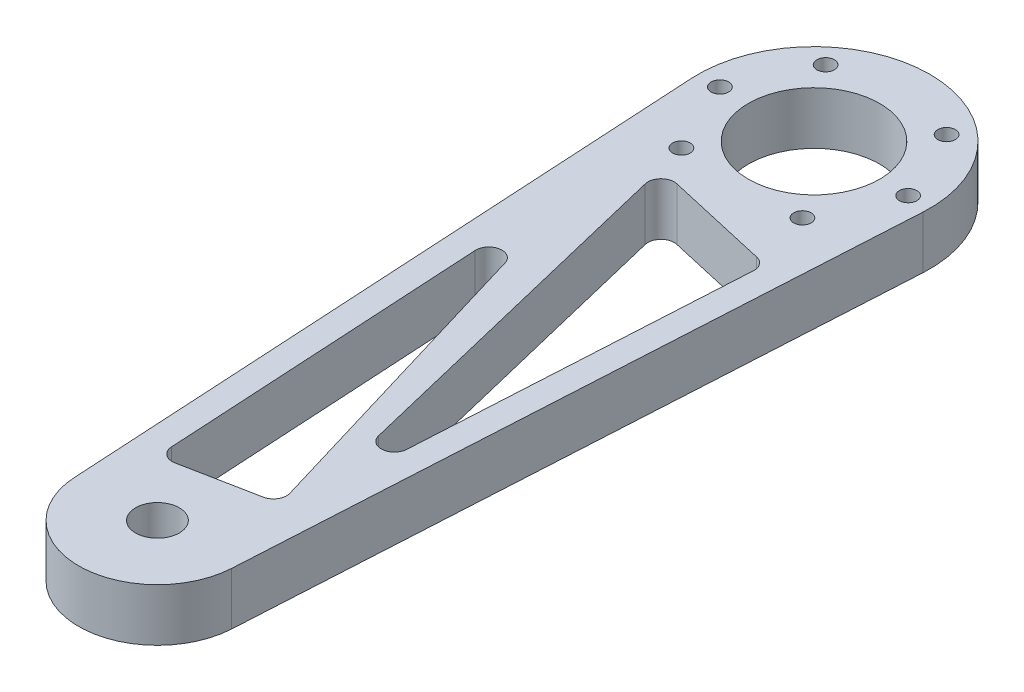
from build123d import *

# Parameters (mm, degrees)
SKETCH_1_R               = 5
SKETCH_1_R_2             = 15
EXTRUDE_1_DEPTH          = 12
FILLET_1_R               = 3
SKETCH_2_R               = 2
CUT_EXTRUDE_1_DEPTH      = 179.881245523
PATTERN_CIRCULAR_3_COUNT = 2
PATTERN_CIRCULAR_3_ANGLE = 50
PATTERN_CIRCULAR_4_COUNT = 2
PATTERN_CIRCULAR_4_ANGLE = 50


with BuildPart() as part:
    # 草图1 → 凸台-拉伸1 (new body)
    with BuildSketch(Plane(origin=(0, 0, 0), x_dir=(1, 0, 0), z_dir=(0, 1, 0))):
        with BuildLine():
            Line((-17.971076762, -1.02), (-26.457418567, 148.498333333))
            ThreePointArc((-26.457418567, 148.498333333), (0, 176.5), (26.457418567, 148.498333333))
            Line((26.457418567, 148.498333333), (17.971076762, -1.02))
            ThreePointArc((17.971076762, -1.02), (0, -18), (-17.971076762, -1.02))
        make_face()
        with Locations(Location((0, 0, 0), (0, 0, 270))):
            Circle(SKETCH_1_R, mode=Mode.SUBTRACT)
        with Locations(Location((0, 150, 0), (0, 0, 270))):
            Circle(SKETCH_1_R_2, mode=Mode.SUBTRACT)
        Polygon((-12.740980954, 12.714849757), (-18.554385191, 115.139490738), (10.712851955, 17.329399023), align=None, mode=Mode.SUBTRACT)
        Polygon((13.283215706, 22.268322657), (18.830257334, 120), (-12, 127), align=None, mode=Mode.SUBTRACT)
    extrude(amount=EXTRUDE_1_DEPTH)

    # 圆角1
    fillet_1_edges = [part.edges().sort_by_distance(p)[0] for p in [
        (-12.740980954, 6, -12.714849757),
        (10.712851955, 6, -17.329399023),
        (-18.554385191, 6, -115.139490738),
        (18.830257334, 6, -120),
        (-12, 6, -127),
        (13.283215706, 6, -22.268322657),
    ]]
    fillet(fillet_1_edges, radius=FILLET_1_R)

    # 草图2 → 切除-拉伸1 (cut, through all)
    with BuildSketch(Plane(origin=(0, 12, 0), x_dir=(1, 0, 0), z_dir=(0, 1, 0))):
        with Locations(Location((-21.5, 150, 0), (0, 0, 270))):
            Circle(SKETCH_2_R)
        with Locations(Location((21.5, 150, 0), (0, 0, 270))):
            Circle(SKETCH_2_R)
    cut_extrude_1 = extrude(amount=-CUT_EXTRUDE_1_DEPTH, mode=Mode.SUBTRACT)

    # 阵列(圆周)3: 切除-拉伸1 ×2 about axis
    pattern_circular_3_axis = Axis((0, 0, -150), (0, 1, 0))
    for i in range(1, PATTERN_CIRCULAR_3_COUNT):
        add(cut_extrude_1.rotate(pattern_circular_3_axis, i * PATTERN_CIRCULAR_3_ANGLE / (PATTERN_CIRCULAR_3_COUNT - 1)), mode=Mode.SUBTRACT)

    # 阵列(圆周)4: 切除-拉伸1 ×2 about axis
    pattern_circular_4_axis = Axis((0, 0, -150), (0, -1, 0))
    for i in range(1, PATTERN_CIRCULAR_4_COUNT):
        add(cut_extrude_1.rotate(pattern_circular_4_axis, i * PATTERN_CIRCULAR_4_ANGLE / (PATTERN_CIRCULAR_4_COUNT - 1)), mode=Mode.SUBTRACT)


solid = part.part
